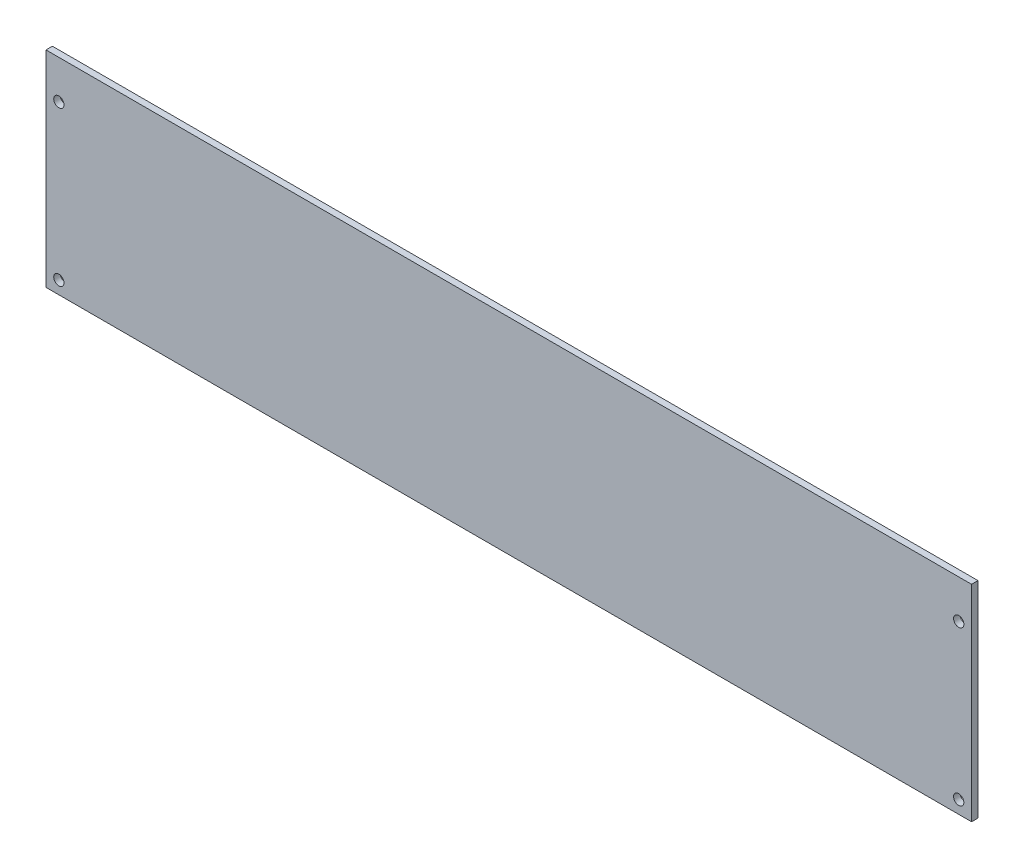
from build123d import *

# Parameters (mm, degrees)
SKETCH1_W           = 457.2
SKETCH1_H           = 101.6
SKETCH1_R           = 2.54
BOSS_EXTRUDE1_DEPTH = 3.175


with BuildPart() as part:
    # Sketch1 → Boss-Extrude1 (new body)
    with BuildSketch(Plane.XY):
        with Locations((-152.926970954, 34.531939703)):
            Rectangle(SKETCH1_W, SKETCH1_H)
        with Locations((-375.176970954, 66.281939703)):
            Circle(SKETCH1_R, mode=Mode.SUBTRACT)
        with Locations((-375.176970954, -9.918060297)):
            Circle(SKETCH1_R, mode=Mode.SUBTRACT)
        with Locations((69.323029046, 66.281939703)):
            Circle(SKETCH1_R, mode=Mode.SUBTRACT)
        with Locations((69.323029046, -9.918060297)):
            Circle(SKETCH1_R, mode=Mode.SUBTRACT)
    extrude(amount=-BOSS_EXTRUDE1_DEPTH)


solid = part.part
